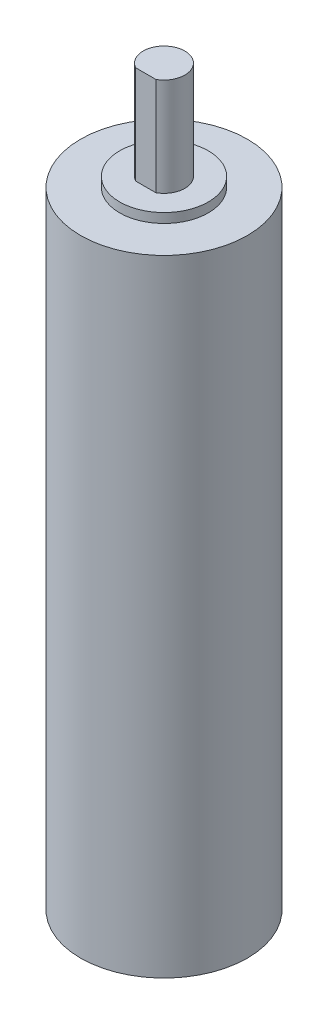
from build123d import *

# Parameters (mm, degrees)
SKETCH1_R           = 16
BOSS_EXTRUDE1_DEPTH = 120
SKETCH2_R           = 8.5
BOSS_EXTRUDE2_DEPTH = 1.82
BOSS_EXTRUDE3_DEPTH = 18.82


with BuildPart() as part:
    # Sketch1 → Boss-Extrude1 (new body)
    with BuildSketch(Plane(origin=(0, 0, 0), x_dir=(1, 0, 0), z_dir=(0, 1, 0))):
        with Locations(Location((0, 0, 0), (0, 0, 270))):
            Circle(SKETCH1_R)
    extrude(amount=BOSS_EXTRUDE1_DEPTH)

    # Sketch2 → Boss-Extrude2 (add)
    with BuildSketch(Plane(origin=(0, 120, 0), x_dir=(1, 0, 0), z_dir=(0, 1, 0))):
        with Locations(Location((0, 0, 0), (0, 0, 270))):
            Circle(SKETCH2_R)
    extrude(amount=BOSS_EXTRUDE2_DEPTH)

    # Sketch3 → Boss-Extrude3 (add)
    with BuildSketch(Plane(origin=(0, 121.82, 0), x_dir=(1, 0, 0), z_dir=(0, 1, 0))):
        with BuildLine():
            Line((-1.936491673, -3.5), (1.936491673, -3.5))
            ThreePointArc((1.936491673, -3.5), (0, 4), (-1.936491673, -3.5))
        make_face()
    extrude(amount=BOSS_EXTRUDE3_DEPTH)


solid = part.part
